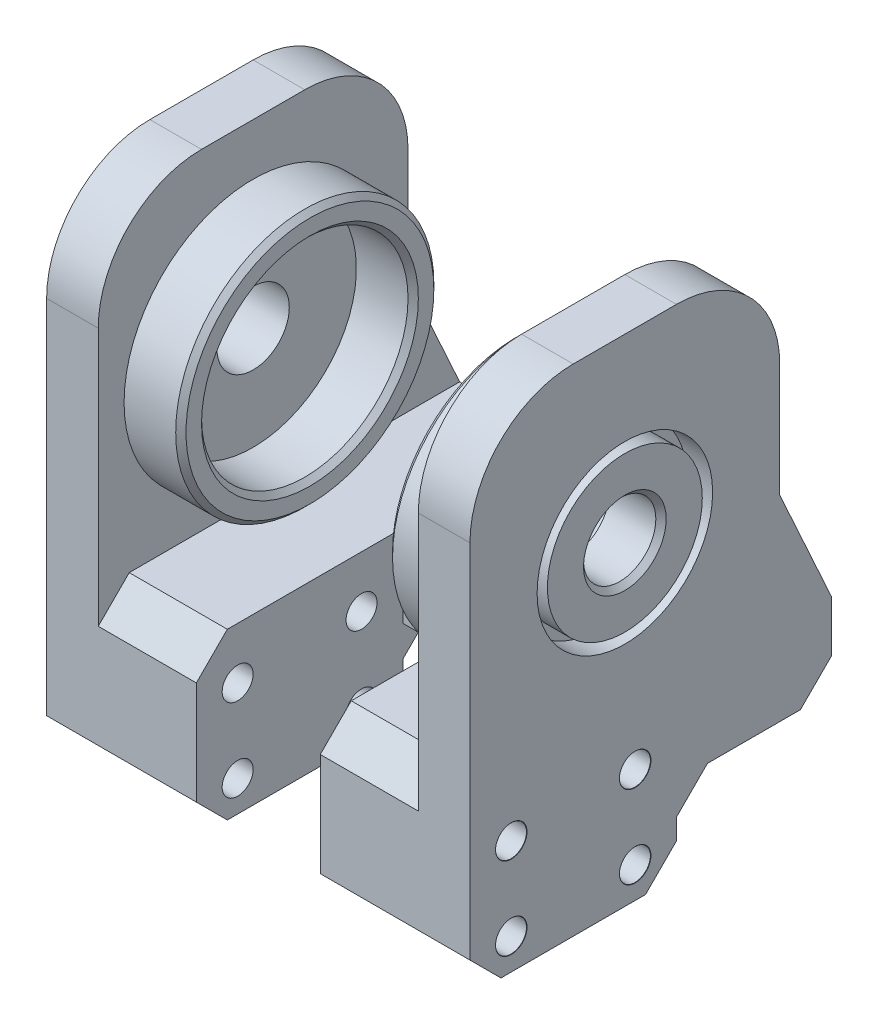
from build123d import *

# Parameters (mm, degrees)
SKETCH_1_R            = 13.5
EXTRUDE_1_DEPTH       = 8
SKETCH_7_W            = 34
SKETCH_7_H            = 30
SKETCH_7_R            = 13.5
EXTRUDE_2_DEPTH       = 8
SKETCH_11_W           = 5
SKETCH_11_H           = 30
EXTRUDE_6_DEPTH       = 40
FILLET_2_R            = 10
SKETCH_13_R           = 8.5
SKETCH_13_R_2         = 7.5
CUT_EXTRUDE_3_DEPTH   = 2.5
SKETCH_14_R           = 3.5
CUT_EXTRUDE_4_DEPTH   = 36
SKETCH_22_W           = 41
SKETCH_22_H           = 5
EXTRUDE_8_DEPTH       = 8
SKETCH_23_W           = 12
SKETCH_23_H           = 8
CUT_EXTRUDE_6_DEPTH   = 20
RIB_1_REACH           = 62.671
SKETCH_24_WALL_W      = 135.42553647
SKETCH_24_WALL_H      = 5
EXTRUDE_9_DEPTH       = 4
F_3_0MM_1_D           = 3
F_3_0MM_1_CSINK_D     = 3.05
F_3_0MM_1_CSINK_ANGLE = 90
SKETCH_27_W           = 14.5
SKETCH_27_H           = 20
EXTRUDE_10_DEPTH      = 8
F_3_0MM_2_D           = 3
F_3_0MM_2_CSINK_D     = 3.05
F_3_0MM_2_CSINK_ANGLE = 90
CHAMFER_5_SIZE        = 3
SKETCH_29_R           = 12.5
SKETCH_29_R_2         = 10
EXTRUDE_11_DEPTH      = 5.5
CHAMFER_4_SIZE        = 0.5


with BuildPart() as part:
    # 草图1 → 凸台-拉伸1 (new body)
    with BuildSketch(Plane(origin=(0, 0, 0), x_dir=(1, 0, 0), z_dir=(0, 1, 0))):
        with Locations(Location((0, 0, 0), (0, 0, 270))):
            Circle(SKETCH_1_R)
    extrude(amount=EXTRUDE_1_DEPTH)

    # 草图7 → 凸台-拉伸2 (add)
    with BuildSketch(Plane.XZ):
        Rectangle(SKETCH_7_W, SKETCH_7_H)
        Circle(SKETCH_7_R, mode=Mode.SUBTRACT)
    extrude(amount=-EXTRUDE_2_DEPTH)

    # 草图11 → 凸台-拉伸6 (add)
    with BuildSketch(Plane.XZ):
        with Locations((-18.5, 0)):
            Rectangle(SKETCH_11_W, SKETCH_11_H)
        with Locations((17.5, 0)):
            Rectangle(SKETCH_11_W, SKETCH_11_H)
    extrude(amount=-EXTRUDE_6_DEPTH)

    # 圆角2
    fillet_2_edges = [part.edges().sort_by_distance(p)[0] for p in [
        (-18.5, 40, -15),
        (-18.5, 40, 15),
        (17.5, 40, 15),
        (17.5, 40, -15),
    ]]
    fillet(fillet_2_edges, radius=FILLET_2_R)

    # 草图13 → 切除-拉伸3 (cut)
    with BuildSketch(Plane(origin=(20, 0, 0), x_dir=(0, 0, -1), z_dir=(1, 0, 0))):
        with Locations((0, 22.5)):
            Circle(SKETCH_13_R)
        with Locations((0, 22.5)):
            Circle(SKETCH_13_R_2, mode=Mode.SUBTRACT)
    cut_extrude_3 = extrude(amount=-CUT_EXTRUDE_3_DEPTH, mode=Mode.SUBTRACT)

    # 草图14 → 切除-拉伸4 (cut)
    with BuildSketch(Plane(origin=(20, 0, 0), x_dir=(0, 0, -1), z_dir=(1, 0, 0))):
        with Locations((0, 22.5)):
            Circle(SKETCH_14_R)
    cut_extrude_4 = extrude(amount=-CUT_EXTRUDE_4_DEPTH, mode=Mode.SUBTRACT)

    # 草图22 → 凸台-拉伸8 (add)
    with BuildSketch(Plane.XZ):
        with Locations((-0.5, -17.5)):
            Rectangle(SKETCH_22_W, SKETCH_22_H)
    extrude(amount=-EXTRUDE_8_DEPTH)

    # 草图23 → 切除-拉伸6 (cut)
    with BuildSketch(Plane.XY.offset(15)):
        with Locations((-0.5, 4)):
            Rectangle(SKETCH_23_W, SKETCH_23_H)
    extrude(amount=-CUT_EXTRUDE_6_DEPTH, mode=Mode.SUBTRACT)

    # 草图24 wall → 筋1 (add, up to next)
    with BuildSketch(Plane(origin=(-21, 13.5, -17.5), x_dir=(0, 0.910366477463, 0.413802944301), z_dir=(0, 0.413802944301, -0.910366477463)), mode=Mode.PRIVATE) as rib_1_sk1:
        with Locations((0, 2.5)):
            Rectangle(SKETCH_24_WALL_W, SKETCH_24_WALL_H)
    rib_1_tool1 = extrude(rib_1_sk1.sketch, amount=-RIB_1_REACH, mode=Mode.PRIVATE) - part.part
    add(rib_1_tool1.solids().sort_by_distance((-21, 13.5, -17.5))[0])

    # 草图25 → 凸台-拉伸9 (add)
    with BuildSketch(Plane(origin=(20, 0, 0), x_dir=(0, 0, -1), z_dir=(1, 0, 0))):
        Polygon((20, 8), (15, 19), (15, 8), align=None)
    extrude(amount=-EXTRUDE_9_DEPTH)

    # Ø3.0mm 暗销孔1 (through all)
    with Locations(Plane(origin=(20, 3, 11), x_dir=(0, 0, 1), z_dir=(1, 0, 0))):
        with Locations((0, 0), (-12, 0)):
            CounterSinkHole(F_3_0MM_1_D / 2, F_3_0MM_1_CSINK_D / 2, counter_sink_angle=F_3_0MM_1_CSINK_ANGLE)

    # 草图27 → 凸台-拉伸10 (add)
    with BuildSketch(Plane.XZ):
        with Locations((-13.75, 5)):
            Rectangle(SKETCH_27_W, SKETCH_27_H)
        with Locations((12.75, 5)):
            Rectangle(SKETCH_27_W, SKETCH_27_H)
    extrude(amount=EXTRUDE_10_DEPTH)

    # Ø3.0mm 暗销孔2 (through all)
    with Locations(Plane(origin=(20, -4.999960937, 11), x_dir=(0, 0, 1), z_dir=(1, 0, 0))):
        with Locations((0, 0), (-12, 0)):
            CounterSinkHole(F_3_0MM_2_D / 2, F_3_0MM_2_CSINK_D / 2, counter_sink_angle=F_3_0MM_2_CSINK_ANGLE)

    # 倒角5
    chamfer_5_edges = [part.edges().sort_by_distance(p)[0] for p in [
        (-0.5, 0, -20),
        (-11.25, 8, 15),
        (-13.75, 0, -5),
        (-13.75, -8, -5),
        (-13.75, -8, 15),
        (12.75, 0, -5),
        (12.75, -8, 15),
        (12.75, -8, -5),
        (10.25, 8, 15),
    ]]
    chamfer(chamfer_5_edges, length=CHAMFER_5_SIZE)

    # 草图29 → 凸台-拉伸11 (add)
    with BuildSketch(Plane.ZY.offset(-15)):
        with Locations((0, 22.5)):
            Circle(SKETCH_29_R)
        with Locations((0, 22.5)):
            Circle(SKETCH_29_R_2, mode=Mode.SUBTRACT)
    extrude_11 = extrude(amount=EXTRUDE_11_DEPTH)

    # 镜向1: 切除-拉伸3, 切除-拉伸4, 凸台-拉伸11 across plane
    add(cut_extrude_3.mirror(Plane.ZY.offset(0.5)), mode=Mode.SUBTRACT)
    add(cut_extrude_4.mirror(Plane.ZY.offset(0.5)), mode=Mode.SUBTRACT)
    add(extrude_11.mirror(Plane.ZY.offset(0.5)))

    # 倒角4
    chamfer_4_edges = [part.edges().sort_by_distance(p)[0] for p in [
        (9.5, 22.5, -12.5),
        (9.5, 22.5, -10),
        (-21, 22.5, 3.5),
        (-10.5, 22.5, -12.5),
        (-10.5, 22.5, -10),
        (20, 22.5, 3.5),
    ]]
    chamfer(chamfer_4_edges, length=CHAMFER_4_SIZE)


solid = part.part
